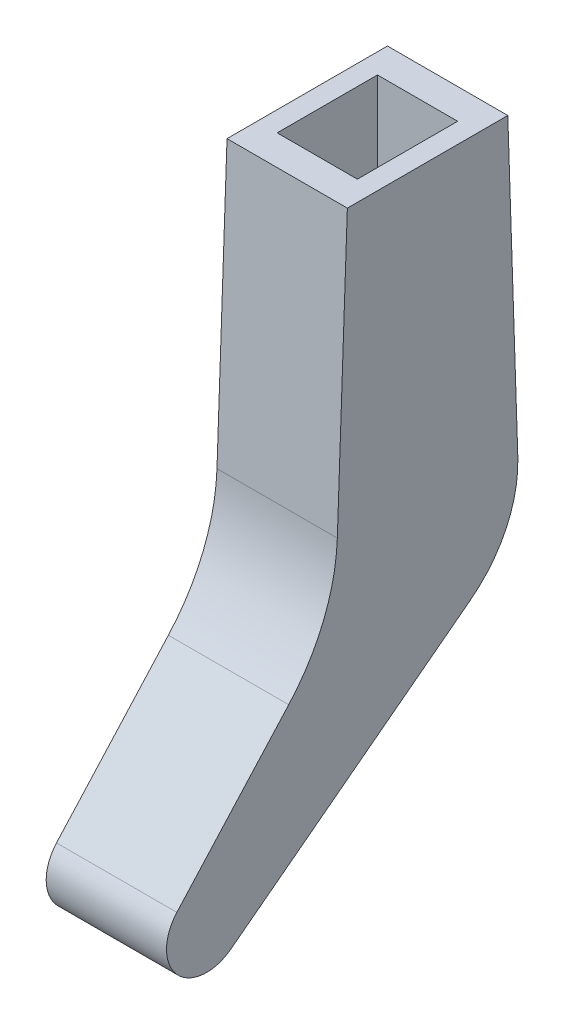
from build123d import *

# Parameters (mm, degrees)
BOSS_EXTRUDE1_DEPTH = 4
BOSS_EXTRUDE2_START = 6
BOSS_EXTRUDE2_DEPTH = 2
BOSS_EXTRUDE3_START = -4
BOSS_EXTRUDE3_DEPTH = 2


with BuildPart() as part:
    # Sketch1 → Boss-Extrude1 (new, symmetric)
    with BuildSketch(Plane(origin=(0, 0, 0), x_dir=(0, 0, -1), z_dir=(1, 0, 0))):
        with BuildLine():
            Line((-5, 0), (-5, 20))
            Line((-5, 20), (-8, 20))
            Line((-8, 20), (-9, -8))
            ThreePointArc((-9, -8), (-10.368373469, -14.408848081), (-13.847540332, -19.962331457))
            Line((-13.847540332, -19.962331457), (-25.002870304, -32.319666758))
            ThreePointArc((-25.002870304, -32.319666758), (-24.977373246, -37.708310367), (-19.609501747, -38.181687186))
            Line((-19.609501747, -38.181687186), (4.253152151, -20))
            ThreePointArc((4.253152151, -20), (7.840921615, -15.576431351), (9, -10))
            Line((9, -10), (8, 20))
            Line((8, 20), (5, 20))
            Line((5, 20), (5, 0))
            ThreePointArc((5, 0), (0, -5), (-5, 0))
        make_face()
    extrude(amount=BOSS_EXTRUDE1_DEPTH, both=True)

    # Sketch1<3> → Boss-Extrude2 (add)
    with BuildSketch(Plane(origin=(0, 0, 0), x_dir=(0, 0, -1), z_dir=(1, 0, 0)).offset(BOSS_EXTRUDE2_START)):
        with BuildLine():
            Line((5, 20), (-5, 20))
            Line((-5, 20), (-5, 0))
            ThreePointArc((-5, 0), (0, 5), (5, 0))
            Line((5, 0), (5, 20))
        make_face()
        with BuildLine():
            Line((-5, 0), (-5, 20))
            Line((-5, 20), (-8, 20))
            Line((-8, 20), (-9, -8))
            ThreePointArc((-9, -8), (-10.368373469, -14.408848081), (-13.847540332, -19.962331457))
            Line((-13.847540332, -19.962331457), (-25.002870304, -32.319666758))
            ThreePointArc((-25.002870304, -32.319666758), (-24.977373246, -37.708310367), (-19.609501747, -38.181687186))
            Line((-19.609501747, -38.181687186), (4.253152151, -20))
            ThreePointArc((4.253152151, -20), (7.840921615, -15.576431351), (9, -10))
            Line((9, -10), (8, 20))
            Line((8, 20), (5, 20))
            Line((5, 20), (5, 0))
            ThreePointArc((5, 0), (0, -5), (-5, 0))
        make_face()
        with BuildLine():
            ThreePointArc((5, 0), (0, 5), (-5, 0))
            Line((-5, 0), (5, 0))
        make_face()
        with BuildLine():
            Line((5, 0), (-5, 0))
            ThreePointArc((-5, 0), (0, -5), (5, 0))
        make_face()
    extrude(amount=-BOSS_EXTRUDE2_DEPTH)

    # Sketch1<4> → Boss-Extrude3 (add)
    with BuildSketch(Plane(origin=(0, 0, 0), x_dir=(0, 0, -1), z_dir=(1, 0, 0)).offset(BOSS_EXTRUDE3_START)):
        with BuildLine():
            ThreePointArc((5, 0), (0, 5), (-5, 0))
            Line((-5, 0), (5, 0))
        make_face()
        with BuildLine():
            Line((5, 0), (-5, 0))
            ThreePointArc((-5, 0), (0, -5), (5, 0))
        make_face()
        with BuildLine():
            Line((5, 20), (-5, 20))
            Line((-5, 20), (-5, 0))
            ThreePointArc((-5, 0), (0, 5), (5, 0))
            Line((5, 0), (5, 20))
        make_face()
        with BuildLine():
            Line((-5, 0), (-5, 20))
            Line((-5, 20), (-8, 20))
            Line((-8, 20), (-9, -8))
            ThreePointArc((-9, -8), (-10.368373469, -14.408848081), (-13.847540332, -19.962331457))
            Line((-13.847540332, -19.962331457), (-25.002870304, -32.319666758))
            ThreePointArc((-25.002870304, -32.319666758), (-24.977373246, -37.708310367), (-19.609501747, -38.181687186))
            Line((-19.609501747, -38.181687186), (4.253152151, -20))
            ThreePointArc((4.253152151, -20), (7.840921615, -15.576431351), (9, -10))
            Line((9, -10), (8, 20))
            Line((8, 20), (5, 20))
            Line((5, 20), (5, 0))
            ThreePointArc((5, 0), (0, -5), (-5, 0))
        make_face()
    extrude(amount=-BOSS_EXTRUDE3_DEPTH)


solid = part.part
